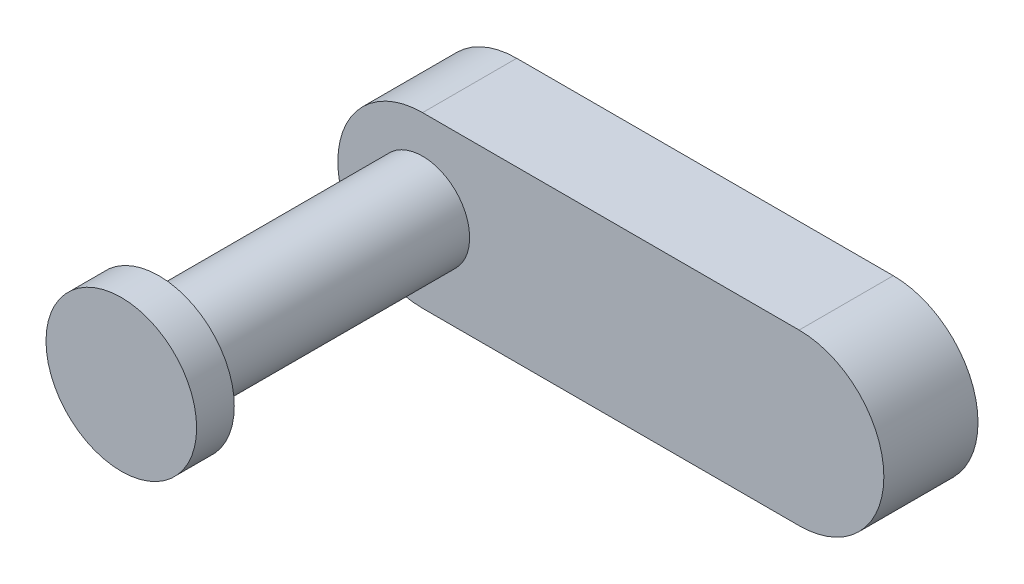
from build123d import *

# Parameters (mm, degrees)
BOSS_EXTRUDE1_DEPTH = 6.35
SKETCH2_R           = 3.175
BOSS_EXTRUDE2_DEPTH = 20.32
SKETCH3_R           = 5.08
BOSS_EXTRUDE3_DEPTH = 2.54


with BuildPart() as part:
    # Sketch1 → Boss-Extrude1 (new body)
    with BuildSketch(Plane.XY):
        with BuildLine():
            Line((0, 5.715), (25.4, 5.715))
            ThreePointArc((25.4, 5.715), (31.115, 0), (25.4, -5.715))
            Line((25.4, -5.715), (0, -5.715))
            ThreePointArc((0, -5.715), (-5.715, 0), (0, 5.715))
        make_face()
    extrude(amount=BOSS_EXTRUDE1_DEPTH)

    # Sketch2 → Boss-Extrude2 (add)
    with BuildSketch(Plane.XY.offset(6.35)):
        with Locations(Location((0, 0, 0), (0, 0, 180))):
            Circle(SKETCH2_R)
    extrude(amount=BOSS_EXTRUDE2_DEPTH)

    # Sketch3 → Boss-Extrude3 (add)
    with BuildSketch(Plane.XY.offset(26.67)):
        Circle(SKETCH3_R)
    extrude(amount=-BOSS_EXTRUDE3_DEPTH)


solid = part.part
